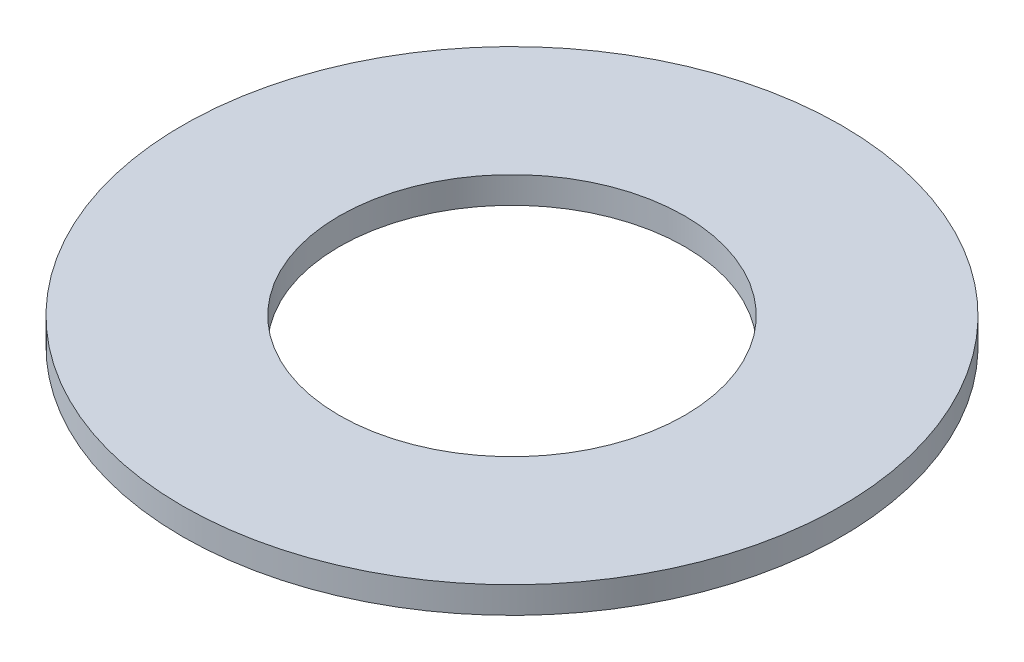
from build123d import *

# Parameters (mm, degrees)
SKETCH1_R           = 62
BOSS_EXTRUDE1_DEPTH = 5
SKETCH5_R           = 32.5
CUT_EXTRUDE2_DEPTH  = 10


with BuildPart() as part:
    # Sketch1 → Boss-Extrude1 (new body)
    with BuildSketch(Plane(origin=(0, 0, 0), x_dir=(1, 0, 0), z_dir=(0, 1, 0))):
        with Locations(Location((0, 0, 0), (0, 0, 270))):
            Circle(SKETCH1_R)
    extrude(amount=BOSS_EXTRUDE1_DEPTH)

    # Sketch5 → Cut-Extrude2 (cut)
    with BuildSketch(Plane.XZ):
        with Locations(Location((0, 0, 0), (0, 0, 270))):
            Circle(SKETCH5_R)
    extrude(amount=-CUT_EXTRUDE2_DEPTH, mode=Mode.SUBTRACT)


solid = part.part
